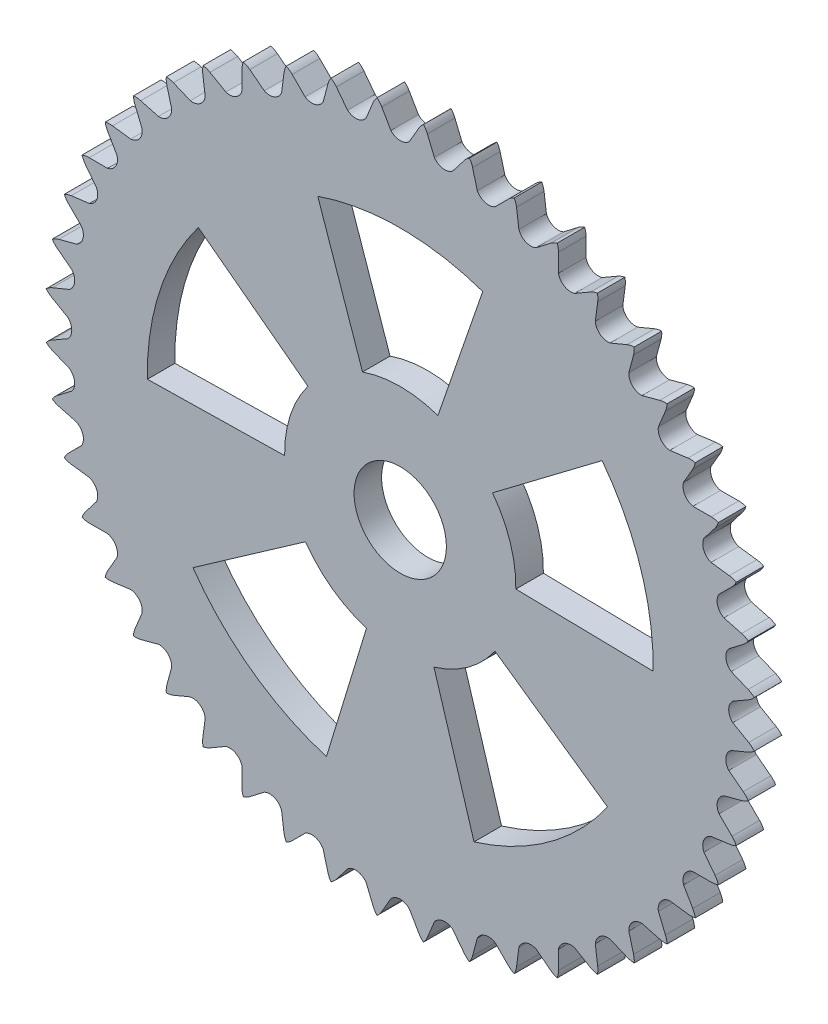
from build123d import *

# Parameters (mm, degrees)
SKETCH1_R           = 12.78
BOSS_EXTRUDE2_DEPTH = 7.62
CUT_EXTRUDE1_DEPTH  = 7.62


with BuildPart() as part:
    # Sketch1 → Boss-Extrude2 (new body)
    with BuildSketch(Plane.XY):
        with BuildLine():
            Line((5.113065676, 96.442677237), (2.589731048, 92.052596493))
            ThreePointArc((2.589731048, 92.052596493), (0, 90.91), (-2.589731048, 92.052596493))
            Line((-2.589731048, 92.052596493), (-5.113065676, 96.442677237))
            ThreePointArc((-5.113065676, 96.442677237), (-5.697982476, 97.276583044), (-6.422753858, 97.992287593))
            ThreePointArc((-6.422753858, 97.992287593), (-7.047906531, 97.188104347), (-7.518972737, 96.284985757))
            Line((-7.518972737, 96.284985757), (-9.447699364, 91.603101502))
            ThreePointArc((-9.447699364, 91.603101502), (-11.866136135, 90.132252347), (-14.582850444, 90.927046037))
            Line((-14.582850444, 90.927046037), (-17.657618118, 94.95020777))
            ThreePointArc((-17.657618118, 94.95020777), (-18.346377423, 95.700632435), (-19.158366475, 96.315612384))
            ThreePointArc((-19.158366475, 96.315612384), (-19.673203903, 95.436710239), (-20.022359442, 94.479831476))
            Line((-20.022359442, 94.479831476), (-21.323477021, 89.586252047))
            ThreePointArc((-21.323477021, 89.586252047), (-23.52923939, 87.812316868), (-26.326453226, 88.245708613))
            Line((-26.326453226, 88.245708613), (-29.900043818, 91.833113924))
            ThreePointArc((-29.900043818, 91.833113924), (-30.680860766, 92.487217472), (-31.56617413, 92.990950343))
            ThreePointArc((-31.56617413, 92.990950343), (-31.961887302, 92.052367558), (-32.183158025, 91.058101083))
            Line((-32.183158025, 91.058101083), (-32.834404074, 86.036556981))
            ThreePointArc((-32.834404074, 86.036556981), (-34.789750836, 83.989888301), (-37.619603094, 84.054462648))
            Line((-37.619603094, 84.054462648), (-41.630871478, 87.144730037))
            ThreePointArc((-41.630871478, 87.144730037), (-42.490386074, 87.691320575), (-43.433875793, 88.075187359))
            ThreePointArc((-43.433875793, 88.075187359), (-43.703693947, 87.092983347), (-43.793293852, 86.078341334))
            Line((-43.793293852, 86.078341334), (-43.78352537, 81.014752572))
            ThreePointArc((-43.78352537, 81.014752572), (-45.455, 78.730369458), (-48.269071123, 78.425021523))
            Line((-48.269071123, 78.425021523), (-52.649383385, 80.965275658))
            ThreePointArc((-52.649383385, 80.965275658), (-53.572889097, 81.395000871), (-54.5584118, 81.652433501))
            ThreePointArc((-54.5584118, 81.652433501), (-54.697718273, 80.643414045), (-54.654114279, 79.6257573))
            Line((-54.654114279, 79.6257573), (-53.983498408, 74.606763284))
            ThreePointArc((-53.983498408, 74.606763284), (-55.342501511, 72.123752166), (-58.092641963, 71.453706537))
            Line((-58.092641963, 71.453706537), (-62.767049745, 73.400482965))
            ThreePointArc((-62.767049745, 73.400482965), (-63.738745133, 73.705990135), (-64.749438254, 73.832583868))
            ThreePointArc((-64.749438254, 73.832583868), (-64.755849473, 72.814013569), (-64.579787658, 71.810754482))
            Line((-64.579787658, 71.810754482), (-63.259798821, 66.922231592))
            ThreePointArc((-63.259798821, 66.922231592), (-64.283077478, 64.283077478), (-66.922231592, 63.259798821))
            Line((-66.922231592, 63.259798821), (-71.810754482, 64.579787658))
            ThreePointArc((-71.810754482, 64.579787658), (-72.814013569, 64.755849473), (-73.832583868, 64.749438254))
            ThreePointArc((-73.832583868, 64.749438254), (-73.705990135, 63.738745133), (-73.400482965, 62.767049745))
            Line((-73.400482965, 62.767049745), (-71.453706537, 58.092641963))
            ThreePointArc((-71.453706537, 58.092641963), (-72.123752166, 55.342501511), (-74.606763284, 53.983498408))
            Line((-74.606763284, 53.983498408), (-79.6257573, 54.654114279))
            ThreePointArc((-79.6257573, 54.654114279), (-80.643414045, 54.697718273), (-81.652433501, 54.5584118))
            ThreePointArc((-81.652433501, 54.5584118), (-81.395000871, 53.572889097), (-80.965275658, 52.649383385))
            Line((-80.965275658, 52.649383385), (-78.425021523, 48.269071123))
            ThreePointArc((-78.425021523, 48.269071123), (-78.730369458, 45.455), (-81.014752572, 43.78352537))
            Line((-81.014752572, 43.78352537), (-86.078341334, 43.793293852))
            ThreePointArc((-86.078341334, 43.793293852), (-87.092983347, 43.703693947), (-88.075187359, 43.433875793))
            ThreePointArc((-88.075187359, 43.433875793), (-87.691320575, 42.490386074), (-87.144730037, 41.630871478))
            Line((-87.144730037, 41.630871478), (-84.054462648, 37.619603094))
            ThreePointArc((-84.054462648, 37.619603094), (-83.989888301, 34.789750836), (-86.036556981, 32.834404074))
            Line((-86.036556981, 32.834404074), (-91.058101083, 32.183158025))
            ThreePointArc((-91.058101083, 32.183158025), (-92.052367558, 31.961887302), (-92.990950343, 31.56617413))
            ThreePointArc((-92.990950343, 31.56617413), (-92.487217472, 30.680860766), (-91.833113924, 29.900043818))
            Line((-91.833113924, 29.900043818), (-88.245708613, 26.326453226))
            ThreePointArc((-88.245708613, 26.326453226), (-87.812316868, 23.52923939), (-89.586252047, 21.323477021))
            Line((-89.586252047, 21.323477021), (-94.479831476, 20.022359442))
            ThreePointArc((-94.479831476, 20.022359442), (-95.436710239, 19.673203903), (-96.315612384, 19.158366475))
            ThreePointArc((-96.315612384, 19.158366475), (-95.700632435, 18.346377423), (-94.95020777, 17.657618118))
            Line((-94.95020777, 17.657618118), (-90.927046037, 14.582850444))
            ThreePointArc((-90.927046037, 14.582850444), (-90.132252347, 11.866136135), (-91.603101502, 9.447699364))
            Line((-91.603101502, 9.447699364), (-96.284985757, 7.518972737))
            ThreePointArc((-96.284985757, 7.518972737), (-97.188104347, 7.047906531), (-97.992287593, 6.422753858))
            ThreePointArc((-97.992287593, 6.422753858), (-97.276583044, 5.697982476), (-96.442677237, 5.113065676))
            Line((-96.442677237, 5.113065676), (-92.052596493, 2.589731048))
            ThreePointArc((-92.052596493, 2.589731048), (-90.91, 0), (-92.052596493, -2.589731048))
            Line((-92.052596493, -2.589731048), (-96.442677237, -5.113065676))
            ThreePointArc((-96.442677237, -5.113065676), (-97.276583044, -5.697982476), (-97.992287593, -6.422753858))
            ThreePointArc((-97.992287593, -6.422753858), (-97.188104347, -7.047906531), (-96.284985757, -7.518972737))
            Line((-96.284985757, -7.518972737), (-91.603101502, -9.447699364))
            ThreePointArc((-91.603101502, -9.447699364), (-90.132252347, -11.866136135), (-90.927046037, -14.582850444))
            Line((-90.927046037, -14.582850444), (-94.95020777, -17.657618118))
            ThreePointArc((-94.95020777, -17.657618118), (-95.700632435, -18.346377423), (-96.315612384, -19.158366475))
            ThreePointArc((-96.315612384, -19.158366475), (-95.436710239, -19.673203903), (-94.479831476, -20.022359442))
            Line((-94.479831476, -20.022359442), (-89.586252047, -21.323477021))
            ThreePointArc((-89.586252047, -21.323477021), (-87.812316868, -23.52923939), (-88.245708613, -26.326453226))
            Line((-88.245708613, -26.326453226), (-91.833113924, -29.900043818))
            ThreePointArc((-91.833113924, -29.900043818), (-92.487217472, -30.680860766), (-92.990950343, -31.56617413))
            ThreePointArc((-92.990950343, -31.56617413), (-92.052367558, -31.961887302), (-91.058101083, -32.183158025))
            Line((-91.058101083, -32.183158025), (-86.036556981, -32.834404074))
            ThreePointArc((-86.036556981, -32.834404074), (-83.989888301, -34.789750836), (-84.054462648, -37.619603094))
            Line((-84.054462648, -37.619603094), (-87.144730037, -41.630871478))
            ThreePointArc((-87.144730037, -41.630871478), (-87.691320575, -42.490386074), (-88.075187359, -43.433875793))
            ThreePointArc((-88.075187359, -43.433875793), (-87.092983347, -43.703693947), (-86.078341334, -43.793293852))
            Line((-86.078341334, -43.793293852), (-81.014752572, -43.78352537))
            ThreePointArc((-81.014752572, -43.78352537), (-78.730369458, -45.455), (-78.425021523, -48.269071123))
            Line((-78.425021523, -48.269071123), (-80.965275658, -52.649383385))
            ThreePointArc((-80.965275658, -52.649383385), (-81.395000871, -53.572889097), (-81.652433501, -54.5584118))
            ThreePointArc((-81.652433501, -54.5584118), (-80.643414045, -54.697718273), (-79.6257573, -54.654114279))
            Line((-79.6257573, -54.654114279), (-74.606763284, -53.983498408))
            ThreePointArc((-74.606763284, -53.983498408), (-72.123752166, -55.342501511), (-71.453706537, -58.092641963))
            Line((-71.453706537, -58.092641963), (-73.400482965, -62.767049745))
            ThreePointArc((-73.400482965, -62.767049745), (-73.705990135, -63.738745133), (-73.832583868, -64.749438254))
            ThreePointArc((-73.832583868, -64.749438254), (-72.814013569, -64.755849473), (-71.810754482, -64.579787658))
            Line((-71.810754482, -64.579787658), (-66.922231592, -63.259798821))
            ThreePointArc((-66.922231592, -63.259798821), (-64.283077478, -64.283077478), (-63.259798821, -66.922231592))
            Line((-63.259798821, -66.922231592), (-64.579787658, -71.810754482))
            ThreePointArc((-64.579787658, -71.810754482), (-64.755849473, -72.814013569), (-64.749438254, -73.832583868))
            ThreePointArc((-64.749438254, -73.832583868), (-63.738745133, -73.705990135), (-62.767049745, -73.400482965))
            Line((-62.767049745, -73.400482965), (-58.092641963, -71.453706537))
            ThreePointArc((-58.092641963, -71.453706537), (-55.342501511, -72.123752166), (-53.983498408, -74.606763284))
            Line((-53.983498408, -74.606763284), (-54.654114279, -79.6257573))
            ThreePointArc((-54.654114279, -79.6257573), (-54.697718273, -80.643414045), (-54.5584118, -81.652433501))
            ThreePointArc((-54.5584118, -81.652433501), (-53.572889097, -81.395000871), (-52.649383385, -80.965275658))
            Line((-52.649383385, -80.965275658), (-48.269071123, -78.425021523))
            ThreePointArc((-48.269071123, -78.425021523), (-45.455, -78.730369458), (-43.78352537, -81.014752572))
            Line((-43.78352537, -81.014752572), (-43.793293852, -86.078341334))
            ThreePointArc((-43.793293852, -86.078341334), (-43.703693947, -87.092983347), (-43.433875793, -88.075187359))
            ThreePointArc((-43.433875793, -88.075187359), (-42.490386074, -87.691320575), (-41.630871478, -87.144730037))
            Line((-41.630871478, -87.144730037), (-37.619603094, -84.054462648))
            ThreePointArc((-37.619603094, -84.054462648), (-34.789750836, -83.989888301), (-32.834404074, -86.036556981))
            Line((-32.834404074, -86.036556981), (-32.183158025, -91.058101083))
            ThreePointArc((-32.183158025, -91.058101083), (-31.961887302, -92.052367558), (-31.56617413, -92.990950343))
            ThreePointArc((-31.56617413, -92.990950343), (-30.680860766, -92.487217472), (-29.900043818, -91.833113924))
            Line((-29.900043818, -91.833113924), (-26.326453226, -88.245708613))
            ThreePointArc((-26.326453226, -88.245708613), (-23.52923939, -87.812316868), (-21.323477021, -89.586252047))
            Line((-21.323477021, -89.586252047), (-20.022359442, -94.479831476))
            ThreePointArc((-20.022359442, -94.479831476), (-19.673203903, -95.436710239), (-19.158366475, -96.315612384))
            ThreePointArc((-19.158366475, -96.315612384), (-18.346377423, -95.700632435), (-17.657618118, -94.95020777))
            Line((-17.657618118, -94.95020777), (-14.582850444, -90.927046037))
            ThreePointArc((-14.582850444, -90.927046037), (-11.866136135, -90.132252347), (-9.447699364, -91.603101502))
            Line((-9.447699364, -91.603101502), (-7.518972737, -96.284985757))
            ThreePointArc((-7.518972737, -96.284985757), (-7.047906531, -97.188104347), (-6.422753858, -97.992287593))
            ThreePointArc((-6.422753858, -97.992287593), (-5.697982476, -97.276583044), (-5.113065676, -96.442677237))
            Line((-5.113065676, -96.442677237), (-2.589731048, -92.052596493))
            ThreePointArc((-2.589731048, -92.052596493), (0, -90.91), (2.589731048, -92.052596493))
            Line((2.589731048, -92.052596493), (5.113065676, -96.442677237))
            ThreePointArc((5.113065676, -96.442677237), (5.697982476, -97.276583044), (6.422753858, -97.992287593))
            ThreePointArc((6.422753858, -97.992287593), (7.047906531, -97.188104347), (7.518972737, -96.284985757))
            Line((7.518972737, -96.284985757), (9.447699364, -91.603101502))
            ThreePointArc((9.447699364, -91.603101502), (11.866136135, -90.132252347), (14.582850444, -90.927046037))
            Line((14.582850444, -90.927046037), (17.657618118, -94.95020777))
            ThreePointArc((17.657618118, -94.95020777), (18.346377423, -95.700632435), (19.158366475, -96.315612384))
            ThreePointArc((19.158366475, -96.315612384), (19.673203903, -95.436710239), (20.022359442, -94.479831476))
            Line((20.022359442, -94.479831476), (21.323477021, -89.586252047))
            ThreePointArc((21.323477021, -89.586252047), (23.52923939, -87.812316868), (26.326453226, -88.245708613))
            Line((26.326453226, -88.245708613), (29.900043818, -91.833113924))
            ThreePointArc((29.900043818, -91.833113924), (30.680860766, -92.487217472), (31.56617413, -92.990950343))
            ThreePointArc((31.56617413, -92.990950343), (31.961887302, -92.052367558), (32.183158025, -91.058101083))
            Line((32.183158025, -91.058101083), (32.834404074, -86.036556981))
            ThreePointArc((32.834404074, -86.036556981), (34.789750836, -83.989888301), (37.619603094, -84.054462648))
            Line((37.619603094, -84.054462648), (41.630871478, -87.144730037))
            ThreePointArc((41.630871478, -87.144730037), (42.490386074, -87.691320575), (43.433875793, -88.075187359))
            ThreePointArc((43.433875793, -88.075187359), (43.703693947, -87.092983347), (43.793293852, -86.078341334))
            Line((43.793293852, -86.078341334), (43.78352537, -81.014752572))
            ThreePointArc((43.78352537, -81.014752572), (45.455, -78.730369458), (48.269071123, -78.425021523))
            Line((48.269071123, -78.425021523), (52.649383385, -80.965275658))
            ThreePointArc((52.649383385, -80.965275658), (53.572889097, -81.395000871), (54.5584118, -81.652433501))
            ThreePointArc((54.5584118, -81.652433501), (54.697718273, -80.643414045), (54.654114279, -79.6257573))
            Line((54.654114279, -79.6257573), (53.983498408, -74.606763284))
            ThreePointArc((53.983498408, -74.606763284), (55.342501511, -72.123752166), (58.092641963, -71.453706537))
            Line((58.092641963, -71.453706537), (62.767049745, -73.400482965))
            ThreePointArc((62.767049745, -73.400482965), (63.738745133, -73.705990135), (64.749438254, -73.832583868))
            ThreePointArc((64.749438254, -73.832583868), (64.755849473, -72.814013569), (64.579787658, -71.810754482))
            Line((64.579787658, -71.810754482), (63.259798821, -66.922231592))
            ThreePointArc((63.259798821, -66.922231592), (64.283077478, -64.283077478), (66.922231592, -63.259798821))
            Line((66.922231592, -63.259798821), (71.810754482, -64.579787658))
            ThreePointArc((71.810754482, -64.579787658), (72.814013569, -64.755849473), (73.832583868, -64.749438254))
            ThreePointArc((73.832583868, -64.749438254), (73.705990135, -63.738745133), (73.400482965, -62.767049745))
            Line((73.400482965, -62.767049745), (71.453706537, -58.092641963))
            ThreePointArc((71.453706537, -58.092641963), (72.123752166, -55.342501511), (74.606763284, -53.983498408))
            Line((74.606763284, -53.983498408), (79.6257573, -54.654114279))
            ThreePointArc((79.6257573, -54.654114279), (80.643414045, -54.697718273), (81.652433501, -54.5584118))
            ThreePointArc((81.652433501, -54.5584118), (81.395000871, -53.572889097), (80.965275658, -52.649383385))
            Line((80.965275658, -52.649383385), (78.425021523, -48.269071123))
            ThreePointArc((78.425021523, -48.269071123), (78.730369458, -45.455), (81.014752572, -43.78352537))
            Line((81.014752572, -43.78352537), (86.078341334, -43.793293852))
            ThreePointArc((86.078341334, -43.793293852), (87.092983347, -43.703693947), (88.075187359, -43.433875793))
            ThreePointArc((88.075187359, -43.433875793), (87.691320575, -42.490386074), (87.144730037, -41.630871478))
            Line((87.144730037, -41.630871478), (84.054462648, -37.619603094))
            ThreePointArc((84.054462648, -37.619603094), (83.989888301, -34.789750836), (86.036556981, -32.834404074))
            Line((86.036556981, -32.834404074), (91.058101083, -32.183158025))
            ThreePointArc((91.058101083, -32.183158025), (92.052367558, -31.961887302), (92.990950343, -31.56617413))
            ThreePointArc((92.990950343, -31.56617413), (92.487217472, -30.680860766), (91.833113924, -29.900043818))
            Line((91.833113924, -29.900043818), (88.245708613, -26.326453226))
            ThreePointArc((88.245708613, -26.326453226), (87.812316868, -23.52923939), (89.586252047, -21.323477021))
            Line((89.586252047, -21.323477021), (94.479831476, -20.022359442))
            ThreePointArc((94.479831476, -20.022359442), (95.436710239, -19.673203903), (96.315612384, -19.158366475))
            ThreePointArc((96.315612384, -19.158366475), (95.700632435, -18.346377423), (94.95020777, -17.657618118))
            Line((94.95020777, -17.657618118), (90.927046037, -14.582850444))
            ThreePointArc((90.927046037, -14.582850444), (90.132252347, -11.866136135), (91.603101502, -9.447699364))
            Line((91.603101502, -9.447699364), (96.284985757, -7.518972737))
            ThreePointArc((96.284985757, -7.518972737), (97.188104347, -7.047906531), (97.992287593, -6.422753858))
            ThreePointArc((97.992287593, -6.422753858), (97.276583044, -5.697982476), (96.442677237, -5.113065676))
            Line((96.442677237, -5.113065676), (92.052596493, -2.589731048))
            ThreePointArc((92.052596493, -2.589731048), (90.91, 0), (92.052596493, 2.589731048))
            Line((92.052596493, 2.589731048), (96.442677237, 5.113065676))
            ThreePointArc((96.442677237, 5.113065676), (97.276583044, 5.697982476), (97.992287593, 6.422753858))
            ThreePointArc((97.992287593, 6.422753858), (97.188104347, 7.047906531), (96.284985757, 7.518972737))
            Line((96.284985757, 7.518972737), (91.603101502, 9.447699364))
            ThreePointArc((91.603101502, 9.447699364), (90.132252347, 11.866136135), (90.927046037, 14.582850444))
            Line((90.927046037, 14.582850444), (94.95020777, 17.657618118))
            ThreePointArc((94.95020777, 17.657618118), (95.700632435, 18.346377423), (96.315612384, 19.158366475))
            ThreePointArc((96.315612384, 19.158366475), (95.436710239, 19.673203903), (94.479831476, 20.022359442))
            Line((94.479831476, 20.022359442), (89.586252047, 21.323477021))
            ThreePointArc((89.586252047, 21.323477021), (87.812316868, 23.52923939), (88.245708613, 26.326453226))
            Line((88.245708613, 26.326453226), (91.833113924, 29.900043818))
            ThreePointArc((91.833113924, 29.900043818), (92.487217472, 30.680860766), (92.990950343, 31.56617413))
            ThreePointArc((92.990950343, 31.56617413), (92.052367558, 31.961887302), (91.058101083, 32.183158025))
            Line((91.058101083, 32.183158025), (86.036556981, 32.834404074))
            ThreePointArc((86.036556981, 32.834404074), (83.989888301, 34.789750836), (84.054462648, 37.619603094))
            Line((84.054462648, 37.619603094), (87.144730037, 41.630871478))
            ThreePointArc((87.144730037, 41.630871478), (87.691320575, 42.490386074), (88.075187359, 43.433875793))
            ThreePointArc((88.075187359, 43.433875793), (87.092983347, 43.703693947), (86.078341334, 43.793293852))
            Line((86.078341334, 43.793293852), (81.014752572, 43.78352537))
            ThreePointArc((81.014752572, 43.78352537), (78.730369458, 45.455), (78.425021523, 48.269071123))
            Line((78.425021523, 48.269071123), (80.965275658, 52.649383385))
            ThreePointArc((80.965275658, 52.649383385), (81.395000871, 53.572889097), (81.652433501, 54.5584118))
            ThreePointArc((81.652433501, 54.5584118), (80.643414045, 54.697718273), (79.6257573, 54.654114279))
            Line((79.6257573, 54.654114279), (74.606763284, 53.983498408))
            ThreePointArc((74.606763284, 53.983498408), (72.123752166, 55.342501511), (71.453706537, 58.092641963))
            Line((71.453706537, 58.092641963), (73.400482965, 62.767049745))
            ThreePointArc((73.400482965, 62.767049745), (73.705990135, 63.738745133), (73.832583868, 64.749438254))
            ThreePointArc((73.832583868, 64.749438254), (72.814013569, 64.755849473), (71.810754482, 64.579787658))
            Line((71.810754482, 64.579787658), (66.922231592, 63.259798821))
            ThreePointArc((66.922231592, 63.259798821), (64.283077478, 64.283077478), (63.259798821, 66.922231592))
            Line((63.259798821, 66.922231592), (64.579787658, 71.810754482))
            ThreePointArc((64.579787658, 71.810754482), (64.755849473, 72.814013569), (64.749438254, 73.832583868))
            ThreePointArc((64.749438254, 73.832583868), (63.738745133, 73.705990135), (62.767049745, 73.400482965))
            Line((62.767049745, 73.400482965), (58.092641963, 71.453706537))
            ThreePointArc((58.092641963, 71.453706537), (55.342501511, 72.123752166), (53.983498408, 74.606763284))
            Line((53.983498408, 74.606763284), (54.654114279, 79.6257573))
            ThreePointArc((54.654114279, 79.6257573), (54.697718273, 80.643414045), (54.5584118, 81.652433501))
            ThreePointArc((54.5584118, 81.652433501), (53.572889097, 81.395000871), (52.649383385, 80.965275658))
            Line((52.649383385, 80.965275658), (48.269071123, 78.425021523))
            ThreePointArc((48.269071123, 78.425021523), (45.455, 78.730369458), (43.78352537, 81.014752572))
            Line((43.78352537, 81.014752572), (43.793293852, 86.078341334))
            ThreePointArc((43.793293852, 86.078341334), (43.703693947, 87.092983347), (43.433875793, 88.075187359))
            ThreePointArc((43.433875793, 88.075187359), (42.490386074, 87.691320575), (41.630871478, 87.144730037))
            Line((41.630871478, 87.144730037), (37.619603094, 84.054462648))
            ThreePointArc((37.619603094, 84.054462648), (34.789750836, 83.989888301), (32.834404074, 86.036556981))
            Line((32.834404074, 86.036556981), (32.183158025, 91.058101083))
            ThreePointArc((32.183158025, 91.058101083), (31.961887302, 92.052367558), (31.56617413, 92.990950343))
            ThreePointArc((31.56617413, 92.990950343), (30.680860766, 92.487217472), (29.900043818, 91.833113924))
            Line((29.900043818, 91.833113924), (26.326453226, 88.245708613))
            ThreePointArc((26.326453226, 88.245708613), (23.52923939, 87.812316868), (21.323477021, 89.586252047))
            Line((21.323477021, 89.586252047), (20.022359442, 94.479831476))
            ThreePointArc((20.022359442, 94.479831476), (19.673203903, 95.436710239), (19.158366475, 96.315612384))
            ThreePointArc((19.158366475, 96.315612384), (18.346377423, 95.700632435), (17.657618118, 94.95020777))
            Line((17.657618118, 94.95020777), (14.582850444, 90.927046037))
            ThreePointArc((14.582850444, 90.927046037), (11.866136135, 90.132252347), (9.447699364, 91.603101502))
            Line((9.447699364, 91.603101502), (7.518972737, 96.284985757))
            ThreePointArc((7.518972737, 96.284985757), (7.047906531, 97.188104347), (6.422753858, 97.992287593))
            ThreePointArc((6.422753858, 97.992287593), (5.697982476, 97.276583044), (5.113065676, 96.442677237))
        make_face()
        Circle(SKETCH1_R, mode=Mode.SUBTRACT)
    extrude(amount=BOSS_EXTRUDE2_DEPTH)

    # Sketch3 → Cut-Extrude1 (cut)
    with BuildSketch(Plane.XY.offset(7.62)):
        with BuildLine():
            Line((55.878364488, 42.161693303), (25.544395194, 19.273916938))
            ThreePointArc((25.544395194, 19.273916938), (30.433808521, 9.88854382), (31.994773954, -0.578307577))
            Line((31.994773954, -0.578307577), (69.988568024, -1.265047825))
            ThreePointArc((69.988568024, -1.265047825), (66.573956141, 21.631189606), (55.878364488, 42.161693303))
        make_face()
        with BuildLine():
            Line((-22.830788909, 66.172162408), (-10.436932073, 30.250131387))
            ThreePointArc((-10.436932073, 30.250131387), (0, 32), (10.436932073, 30.250131387))
            Line((10.436932073, 30.250131387), (22.830788909, 66.172162408))
            ThreePointArc((22.830788909, 66.172162408), (0, 70), (-22.830788909, 66.172162408))
        make_face()
        with BuildLine():
            Line((57.365517398, -40.114802924), (26.224236525, -18.338195622))
            ThreePointArc((26.224236525, -18.338195622), (18.809128073, -25.88854382), (9.336925693, -30.607545125))
            Line((9.336925693, -30.607545125), (20.424524954, -66.954004962))
            ThreePointArc((20.424524954, -66.954004962), (41.14496766, -56.631189606), (57.365517398, -40.114802924))
        make_face()
        with BuildLine():
            Line((-20.424524954, -66.954004962), (-9.336925693, -30.607545125))
            ThreePointArc((-9.336925693, -30.607545125), (-18.809128073, -25.88854382), (-26.224236525, -18.338195622))
            Line((-26.224236525, -18.338195622), (-57.365517398, -40.114802924))
            ThreePointArc((-57.365517398, -40.114802924), (-41.14496766, -56.631189606), (-20.424524954, -66.954004962))
        make_face()
        with BuildLine():
            Line((-69.988568024, -1.265047825), (-31.994773954, -0.578307577))
            ThreePointArc((-31.994773954, -0.578307577), (-30.433808521, 9.88854382), (-25.544395194, 19.273916938))
            Line((-25.544395194, 19.273916938), (-55.878364488, 42.161693303))
            ThreePointArc((-55.878364488, 42.161693303), (-66.573956141, 21.631189606), (-69.988568024, -1.265047825))
        make_face()
    extrude(amount=-CUT_EXTRUDE1_DEPTH, mode=Mode.SUBTRACT)


solid = part.part
